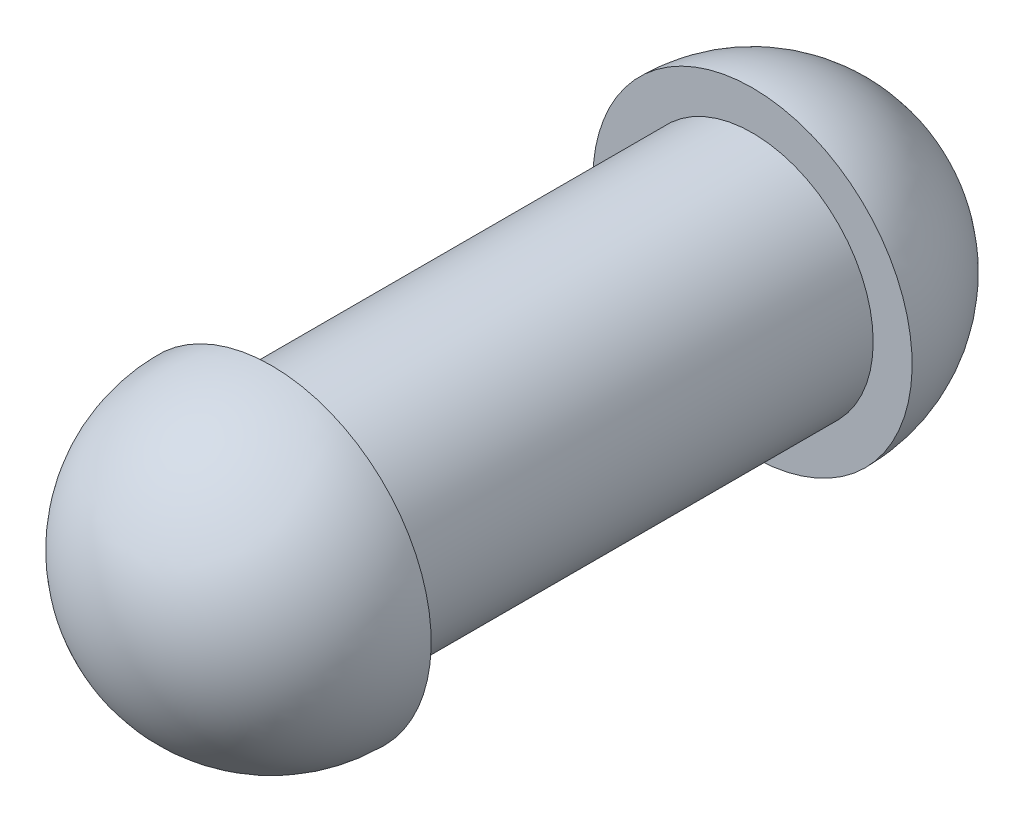
from build123d import *

# Parameters (mm, degrees)
SKETCH1_R           = 15.5
BOSS_EXTRUDE1_DEPTH = 30.875


with BuildPart() as part:
    # Sketch1 → Boss-Extrude1 (new, symmetric)
    with BuildSketch(Plane.XY):
        Circle(SKETCH1_R)
    extrude(amount=BOSS_EXTRUDE1_DEPTH, both=True)

    # Sketch2 → Revolve1 (revolve)
    with BuildSketch(Plane(origin=(0, 0, 0), x_dir=(0, 0, -1), z_dir=(1, 0, 0))):
        with BuildLine():
            Line((-51.375, 0), (-30.875, 0))
            Line((-30.875, 0), (-30.875, 20.5))
            ThreePointArc((-30.875, 20.5), (-45.370689014, 14.495689014), (-51.375, 0))
        make_face()
    revolve(axis=Axis((0, 0, 0), (0, 0, 1)))

    # Mirror1: part across plane


with BuildPart() as part_1:
    add(part.part)
    add(part.part.mirror(Plane.XY))


solid = part_1.part
